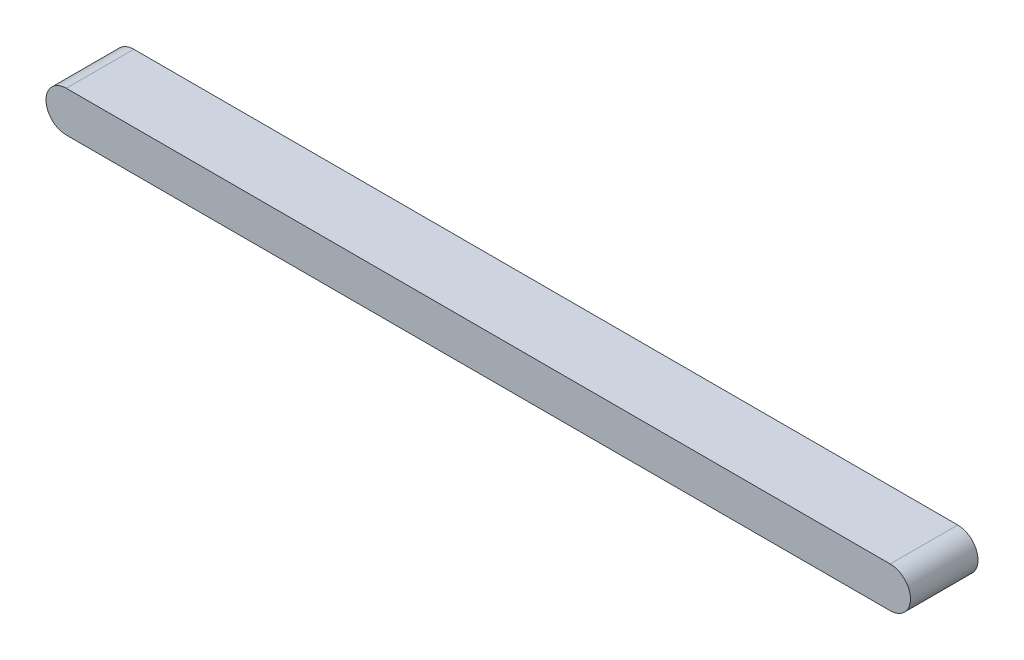
from build123d import *

# Parameters (mm, degrees)
BOSS_EXTRUDE1_DEPTH = 10


with BuildPart() as part:
    # Sketch1 → Boss-Extrude1 (new body)
    with BuildSketch(Plane.XY):
        with BuildLine():
            Line((0, 0), (122, 0))
            ThreePointArc((122, 0), (125, -3), (122, -6))
            Line((122, -6), (0, -6))
            ThreePointArc((0, -6), (-3, -3), (0, 0))
        make_face()
    extrude(amount=BOSS_EXTRUDE1_DEPTH)


solid = part.part
